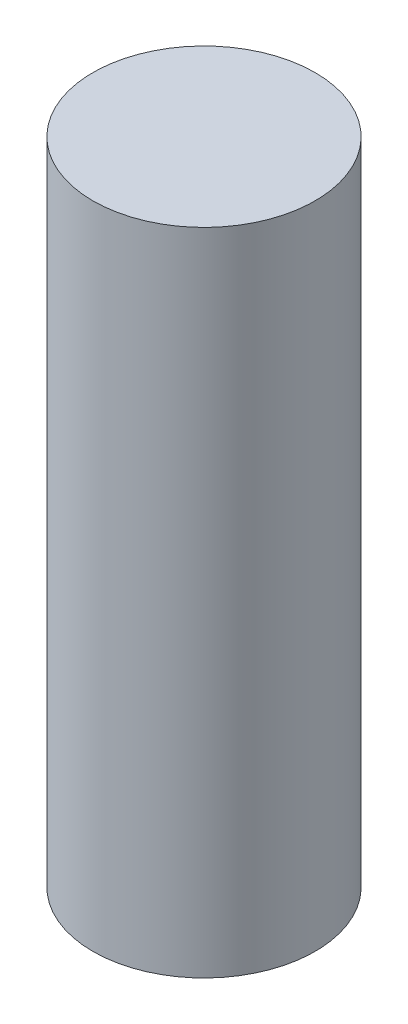
from build123d import *

# Parameters (mm, degrees)
SKETCH1_R           = 20
BOSS_EXTRUDE1_DEPTH = 117


with BuildPart() as part:
    # Sketch1 → Boss-Extrude1 (new body)
    with BuildSketch(Plane(origin=(0, 0, 0), x_dir=(1, 0, 0), z_dir=(0, 1, 0))):
        with Locations(Location((0, 0, 0), (0, 0, 270))):
            Circle(SKETCH1_R)
    extrude(amount=BOSS_EXTRUDE1_DEPTH)


solid = part.part
